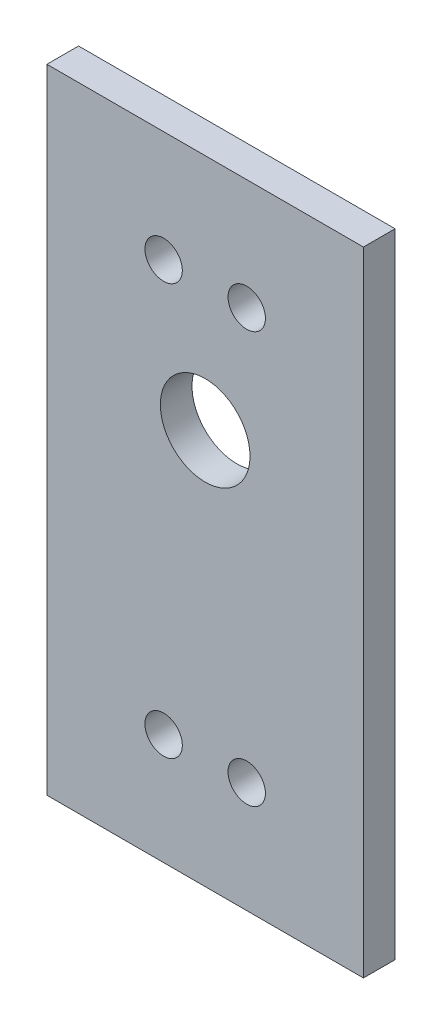
from build123d import *

# Parameters (mm, degrees)
SKETCH1_W            = 38.1
SKETCH1_H            = 76.2
BOSS_EXTRUDE1_DEPTH  = 3.81
M4_CLEARANCE_HOLE1_D = 4.5
CUT_EXTRUDE1_REACH   = 44.767
SKETCH5_R            = 5.3975


with BuildPart() as part:
    # Sketch1 → Boss-Extrude1 (new body)
    with BuildSketch(Plane.XY):
        Rectangle(SKETCH1_W, SKETCH1_H)
    extrude(amount=BOSS_EXTRUDE1_DEPTH)

    # M4 Clearance Hole1 (through all)
    with Locations(Plane.XY.offset(3.81)):
        with Locations((-5, 24.75), (5, 24.75), (-5, -24.75), (5, -24.75)):
            Hole(M4_CLEARANCE_HOLE1_D / 2)

    # Sketch5 → Cut-Extrude1 (cut, up to next)
    with BuildSketch(Plane.XY.offset(3.81), mode=Mode.PRIVATE) as cut_extrude1_sk1:
        with Locations((0, 9.464)):
            Circle(SKETCH5_R)
    cut_extrude1_tool1 = extrude(cut_extrude1_sk1.sketch, amount=-CUT_EXTRUDE1_REACH, mode=Mode.PRIVATE) & part.part
    add(cut_extrude1_tool1.solids().sort_by_distance((0, 9.464, 3.81))[0], mode=Mode.SUBTRACT)


solid = part.part
